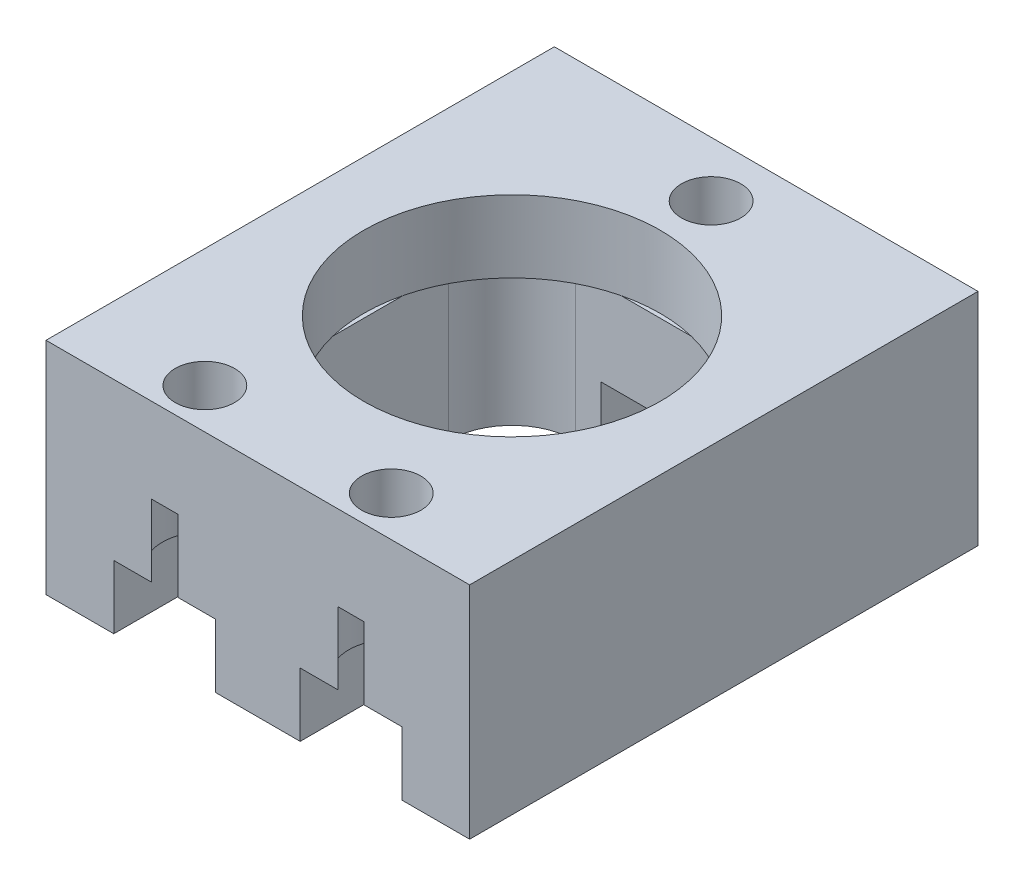
from build123d import *

# Parameters (mm, degrees)
SKETCH_1_W          = 10
SKETCH_1_H          = 12
SKETCH_1_R          = 3.5
EXTRUDE_1_DEPTH     = 1.7
SKETCH_4_W          = 10
SKETCH_4_H          = 12
EXTRUDE_2_DEPTH     = 3.5
CUT_EXTRUDE_START   = 3.5
SKETCH_4_3_W        = 2.4
SKETCH_4_3_H        = 1.9
CUT_EXTRUDE_2_DEPTH = 1.5
SKETCH_5_R          = 0.7
CUT_EXTRUDE_3_DEPTH = 10.382963285
CUT_EXTRUDE_START_2 = -3.7
SKETCH_5_3_R        = 1
CUT_EXTRUDE_4_DEPTH = 1.7
CUT_EXTRUDE_START_3 = -5.2
SKETCH_5_4_R        = 0.3
CUT_EXTRUDE_5_DEPTH = 4


with BuildPart() as part:
    # 草图1 → 凸台-拉伸1 (new body)
    with BuildSketch(Plane(origin=(0, 0, 0), x_dir=(1, 0, 0), z_dir=(0, 1, 0))):
        Rectangle(SKETCH_1_W, SKETCH_1_H)
        with Locations(Location((0, 0, 0), (0, 0, 270))):
            Circle(SKETCH_1_R, mode=Mode.SUBTRACT)
    extrude(amount=EXTRUDE_1_DEPTH)

    # 草图4 → 凸台-拉伸2 (add)
    with BuildSketch(Plane.XZ):
        Rectangle(SKETCH_4_W, SKETCH_4_H)
        with BuildLine():
            Line((3.4, 4.1), (3.4, -1.9))
            ThreePointArc((3.4, -1.9), (2.960660172, -2.960660172), (1.9, -3.4))
            Line((1.9, -3.4), (-1.9, -3.4))
            ThreePointArc((-1.9, -3.4), (-2.960660172, -2.960660172), (-3.4, -1.9))
            Line((-3.4, -1.9), (-3.4, 4.1))
            Line((-3.4, 4.1), (3.4, 4.1))
        make_face(mode=Mode.SUBTRACT)
    extrude(amount=EXTRUDE_2_DEPTH)

    # 草图4<3> → 切除-拉伸2 (cut)
    with BuildSketch(Plane.XZ.offset(CUT_EXTRUDE_START)):
        with Locations((-2.2, 5.05)):
            Rectangle(SKETCH_4_3_W, SKETCH_4_3_H)
        with Locations((2.2, 5.05)):
            Rectangle(SKETCH_4_3_W, SKETCH_4_3_H)
        with BuildLine():
            Line((1.3, -6), (1.3, -3.4))
            Line((1.3, -3.4), (0.830662386, -3.4))
            ThreePointArc((0.830662386, -3.4), (0, -3.5), (-0.830662386, -3.4))
            Line((-0.830662386, -3.4), (-1.3, -3.4))
            Line((-1.3, -3.4), (-1.3, -6))
            Line((-1.3, -6), (1.3, -6))
        make_face()
        with BuildLine():
            ThreePointArc((-0.830662386, -3.4), (0, -3.5), (0.830662386, -3.4))
            Line((0.830662386, -3.4), (-0.830662386, -3.4))
        make_face()
    extrude(amount=-CUT_EXTRUDE_2_DEPTH, mode=Mode.SUBTRACT)

    # 草图5 → 切除-拉伸3 (cut, through all)
    with BuildSketch(Plane(origin=(0, 1.7, 0), x_dir=(1, 0, 0), z_dir=(0, 1, 0))):
        with Locations(Location((0, 4.7, 0), (0, 0, 270))):
            Circle(SKETCH_5_R)
        with Locations(Location((2.2, -5.05, 0), (0, 0, 270))):
            Circle(SKETCH_5_R)
        with Locations(Location((-2.2, -5.05, 0), (0, 0, 270))):
            Circle(SKETCH_5_R)
    extrude(amount=-CUT_EXTRUDE_3_DEPTH, mode=Mode.SUBTRACT)

    # 草图5<3> → 切除-拉伸4 (cut)
    with BuildSketch(Plane(origin=(0, 1.7, 0), x_dir=(1, 0, 0), z_dir=(0, 1, 0)).offset(CUT_EXTRUDE_START_2)):
        with Locations((2.2, -5.05)):
            Circle(SKETCH_5_3_R)
        with Locations((-2.2, -5.05)):
            Circle(SKETCH_5_3_R)
        with Locations(Location((0, 4.7, 0), (0, 0, 90))):
            Circle(SKETCH_5_3_R)
    extrude(amount=CUT_EXTRUDE_4_DEPTH, mode=Mode.SUBTRACT)

    # 草图5<4> → 切除-拉伸5 (cut)
    with BuildSketch(Plane(origin=(0, 1.7, 0), x_dir=(1, 0, 0), z_dir=(0, 1, 0)).offset(CUT_EXTRUDE_START_3)):
        with Locations(Location((3.5, 4.5, 0), (0, 0, 270))):
            Circle(SKETCH_5_4_R)
        with Locations(Location((-3.5, 4.5, 0), (0, 0, 270))):
            Circle(SKETCH_5_4_R)
        with Locations(Location((0, -5.05, 0), (0, 0, 270))):
            Circle(SKETCH_5_4_R)
    extrude(amount=CUT_EXTRUDE_5_DEPTH, mode=Mode.SUBTRACT)


solid = part.part
